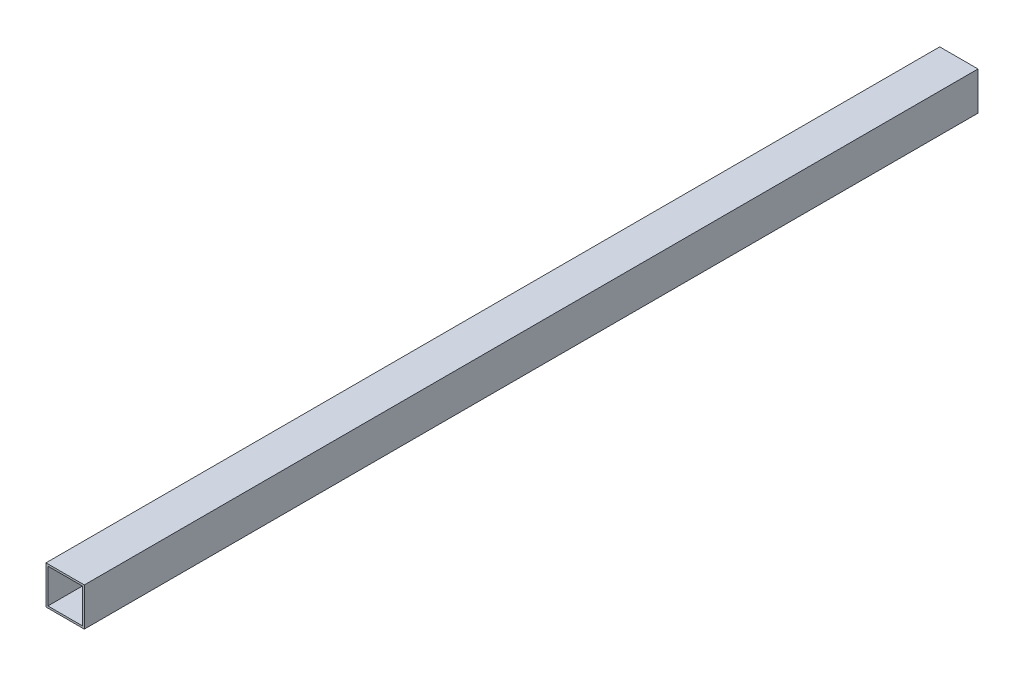
from build123d import *

# Parameters (mm, degrees)
SKETCH1_W           = 60
SKETCH1_H           = 60
SKETCH1_W_2         = 54
SKETCH1_H_2         = 54
BOSS_EXTRUDE1_DEPTH = 1400


with BuildPart() as part:
    # Sketch1 → Boss-Extrude1 (new body)
    with BuildSketch(Plane.XY):
        Rectangle(SKETCH1_W, SKETCH1_H)
        Rectangle(SKETCH1_W_2, SKETCH1_H_2, mode=Mode.SUBTRACT)
    extrude(amount=BOSS_EXTRUDE1_DEPTH)


solid = part.part
